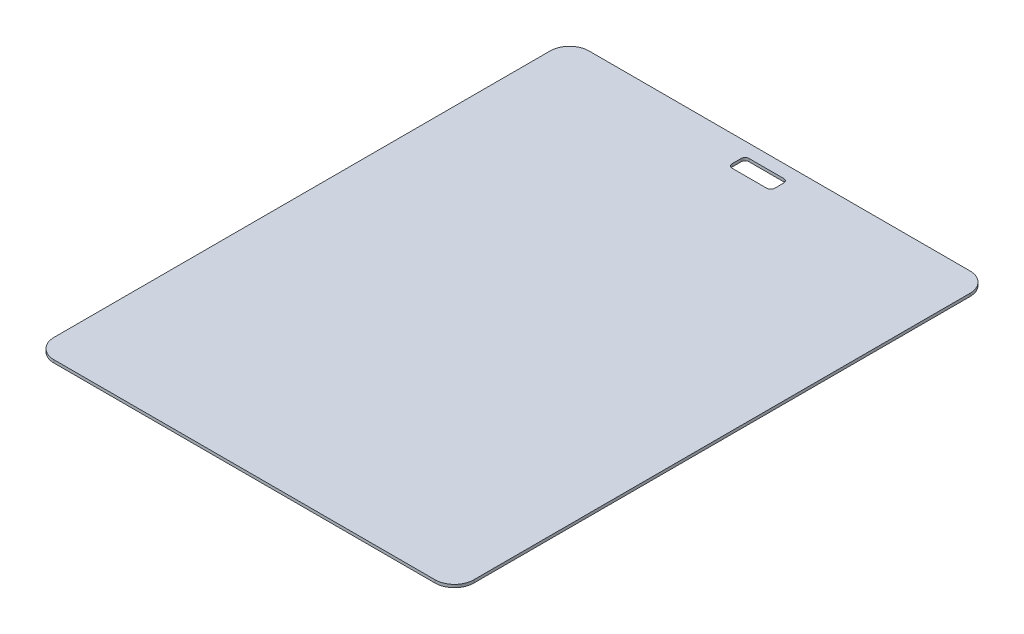
from build123d import *

# Parameters (mm, degrees)
SKETCH1_W           = 217
SKETCH1_H           = 276.5
BOSS_EXTRUDE1_DEPTH = 1.5
FILLET1_R           = 10
SKETCH4_W           = 22
SKETCH4_H           = 8.75
CUT_EXTRUDE2_DEPTH  = 184.114035508
FILLET2_R           = 2


with BuildPart() as part:
    # Sketch1 → Boss-Extrude1 (new body)
    with BuildSketch(Plane(origin=(0, 0, 0), x_dir=(1, 0, 0), z_dir=(0, 1, 0))):
        with Locations((0, 9.25)):
            Rectangle(SKETCH1_W, SKETCH1_H)
    extrude(amount=BOSS_EXTRUDE1_DEPTH)

    # Fillet1
    fillet1_edges = [part.edges().sort_by_distance(p)[0] for p in [
        (-108.5, 0.75, -147.5),
        (108.5, 0.75, -147.5),
        (108.5, 0.75, 129),
        (-108.5, 0.75, 129),
    ]]
    fillet(fillet1_edges, radius=FILLET1_R)

    # Sketch4 → Cut-Extrude2 (cut, through all)
    with BuildSketch(Plane(origin=(0, 1.5, 0), x_dir=(1, 0, 0), z_dir=(0, 1, 0))):
        with Locations((0, 136.355)):
            Rectangle(SKETCH4_W, SKETCH4_H)
    extrude(amount=-CUT_EXTRUDE2_DEPTH, mode=Mode.SUBTRACT)

    # Fillet2
    fillet2_edges = [part.edges().sort_by_distance(p)[0] for p in [
        (-11, 0.75, -131.98),
        (-11, 0.75, -140.73),
        (11, 0.75, -140.73),
        (11, 0.75, -131.98),
    ]]
    fillet(fillet2_edges, radius=FILLET2_R)


solid = part.part
